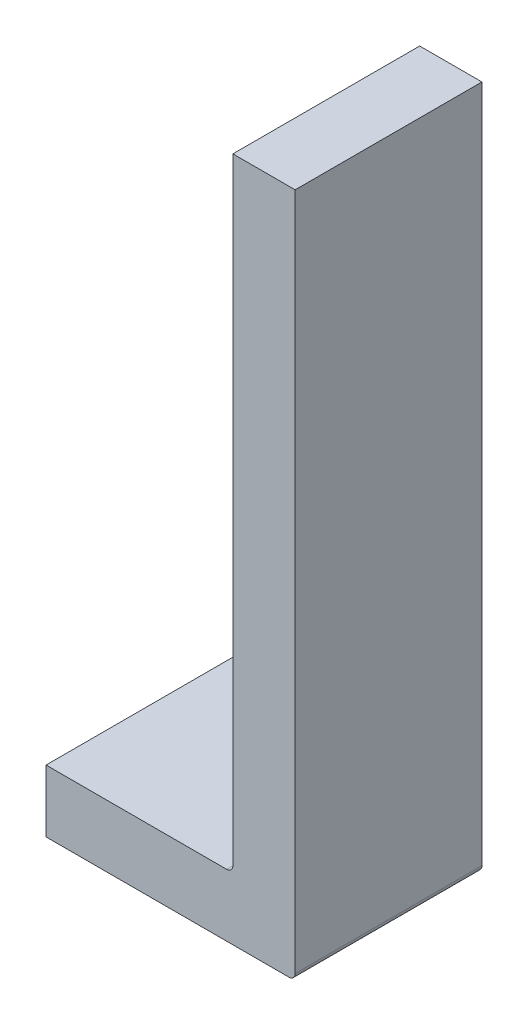
from build123d import *

# Parameters (mm, degrees)
SKETCH2_W           = 20
SKETCH2_H           = 15
BOSS_EXTRUDE1_DEPTH = 5
SKETCH3_W           = 5
SKETCH3_H           = 15
BOSS_EXTRUDE2_DEPTH = 50
FILLET1_R           = 0.5
FILLET2_R           = 0.5


with BuildPart() as part:
    # Sketch2 → Boss-Extrude1 (new body)
    with BuildSketch(Plane(origin=(0, 0, 0), x_dir=(1, 0, 0), z_dir=(0, 1, 0))):
        with Locations((10, 7.5)):
            Rectangle(SKETCH2_W, SKETCH2_H)
    extrude(amount=BOSS_EXTRUDE1_DEPTH)

    # Sketch3 → Boss-Extrude2 (add)
    with BuildSketch(Plane(origin=(0, 5, 0), x_dir=(1, 0, 0), z_dir=(0, 1, 0))):
        with Locations((17.5, 7.5)):
            Rectangle(SKETCH3_W, SKETCH3_H)
    extrude(amount=BOSS_EXTRUDE2_DEPTH)

    # Fillet1
    fillet1_edges = [part.edges().sort_by_distance(p)[0] for p in [
        (20, 0, -7.5),
    ]]
    fillet(fillet1_edges, radius=FILLET1_R)

    # Fillet2
    fillet2_edges = [part.edges().sort_by_distance(p)[0] for p in [
        (15, 5, -7.5),
    ]]
    fillet(fillet2_edges, radius=FILLET2_R)


solid = part.part
